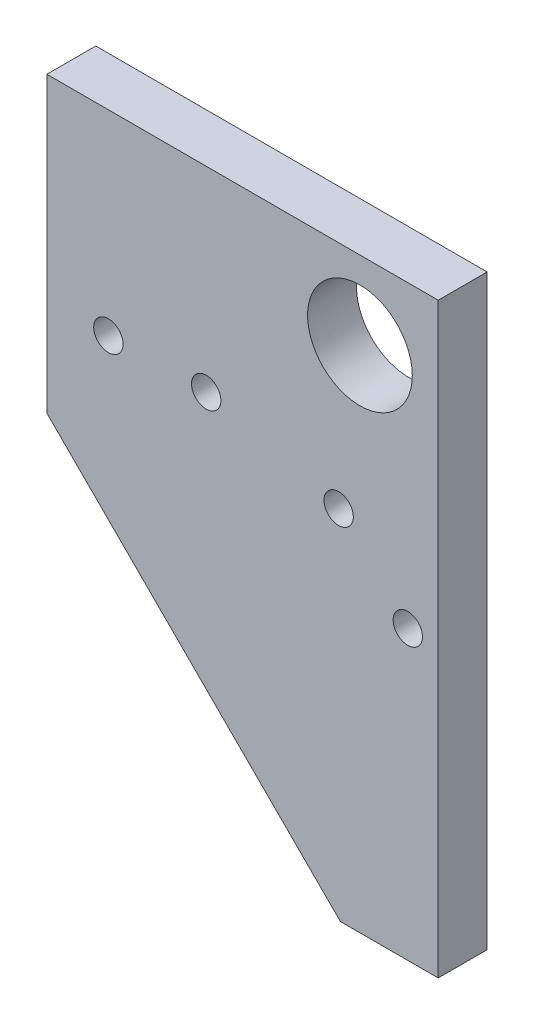
from build123d import *

# Parameters (mm, degrees)
SKETCH1_R           = 1.5
SKETCH1_R_2         = 4
BOSS_EXTRUDE1_DEPTH = 5
SKETCH2_R           = 5.35
CUT_EXTRUDE1_DEPTH  = 5


with BuildPart() as part:
    # Sketch1 → Boss-Extrude1 (new body)
    with BuildSketch(Plane.XY):
        Polygon((-22.417673347, -49.359609207), (-22.417673347, -19.359609207), (17.582326653, -19.359609207), (17.582326653, -79.359609207), (7.582326653, -79.359609207), align=None)
        with Locations((-16.130508289, -39.359609207)):
            Circle(SKETCH1_R, mode=Mode.SUBTRACT)
        with Locations((-6.130508289, -39.359609207)):
            Circle(SKETCH1_R, mode=Mode.SUBTRACT)
        with Locations((7.405025617, -42.895143113)):
            Circle(SKETCH1_R, mode=Mode.SUBTRACT)
        with Locations((14.476093428, -49.966210925)):
            Circle(SKETCH1_R, mode=Mode.SUBTRACT)
        with Locations((9.582326653, -27.359609207)):
            Circle(SKETCH1_R_2, mode=Mode.SUBTRACT)
    extrude(amount=BOSS_EXTRUDE1_DEPTH)

    # Sketch2 → Cut-Extrude1 (cut)
    with BuildSketch(Plane.XY.offset(5)):
        with Locations((9.582326653, -27.359609207)):
            Circle(SKETCH2_R)
    extrude(amount=-CUT_EXTRUDE1_DEPTH, mode=Mode.SUBTRACT)


solid = part.part
